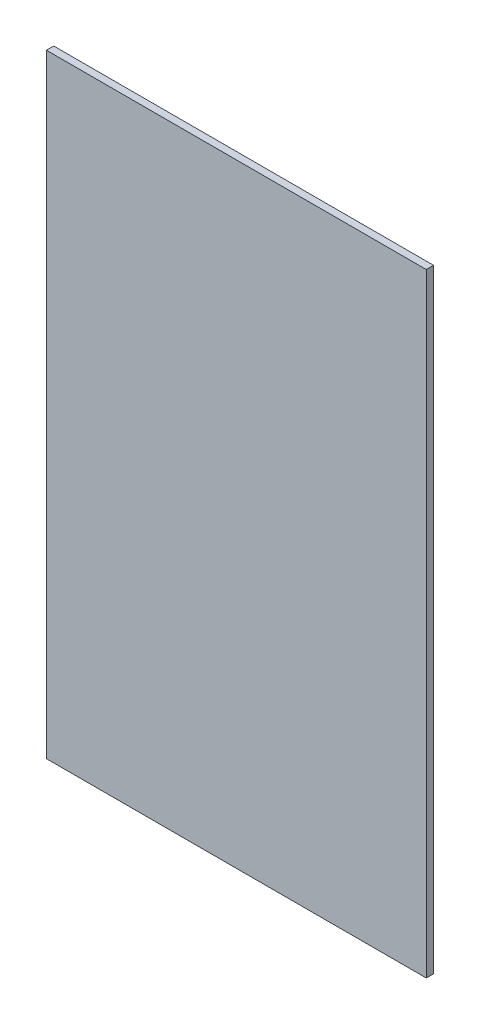
from build123d import *

# Parameters (mm, degrees)
SKETCH1_W           = 330.2
SKETCH1_H           = 533.4
BOSS_EXTRUDE1_DEPTH = 6.35


with BuildPart() as part:
    # Sketch1 → Boss-Extrude1 (new body)
    with BuildSketch(Plane.XY):
        with Locations((146.873326158, -218.335323255)):
            Rectangle(SKETCH1_W, SKETCH1_H)
    extrude(amount=BOSS_EXTRUDE1_DEPTH)


solid = part.part
